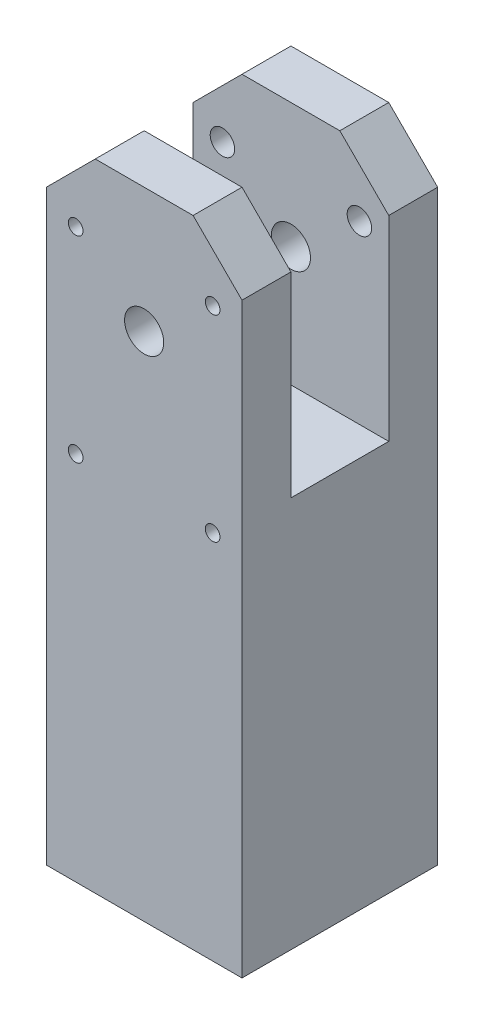
from build123d import *

# Parameters (mm, degrees)
SKETCH1_W           = 40
SKETCH1_H           = 40
BOSS_EXTRUDE1_DEPTH = 80
SKETCH4_W           = 40
SKETCH4_H           = 10
BOSS_EXTRUDE2_DEPTH = 50
CHAMFER1_SIZE       = 10
SKETCH5_R           = 4
CUT_EXTRUDE1_DEPTH  = 60
SKETCH6_R           = 1.5
CUT_EXTRUDE2_DEPTH  = 60
CHAMFER2_SIZE       = 2
SKETCH7_R           = 2.5
CUT_EXTRUDE3_DEPTH  = 20


with BuildPart() as part:
    # Sketch1 → Boss-Extrude1 (new body)
    with BuildSketch(Plane(origin=(0, 0, 0), x_dir=(1, 0, 0), z_dir=(0, 1, 0))):
        with Locations((-136.41025641, 40.096153846)):
            Rectangle(SKETCH1_W, SKETCH1_H)
    extrude(amount=BOSS_EXTRUDE1_DEPTH)

    # Sketch4 → Boss-Extrude2 (add)
    with BuildSketch(Plane(origin=(0, 80, 0), x_dir=(1, 0, 0), z_dir=(0, 1, 0))):
        with Locations((-136.41025641, 25.096153846)):
            Rectangle(SKETCH4_W, SKETCH4_H)
        with Locations((-136.41025641, 55.096153846)):
            Rectangle(SKETCH4_W, SKETCH4_H)
    extrude(amount=BOSS_EXTRUDE2_DEPTH)

    # Chamfer1
    chamfer1_edges = [part.edges().sort_by_distance(p)[0] for p in [
        (-156.41025641, 130, -25.096153846),
        (-116.41025641, 130, -25.096153846),
        (-156.41025641, 130, -55.096153846),
        (-116.41025641, 130, -55.096153846),
    ]]
    chamfer(chamfer1_edges, length=CHAMFER1_SIZE)

    # Sketch5 → Cut-Extrude1 (cut)
    with BuildSketch(Plane(origin=(0, 0, -60.096153846), x_dir=(-1, 0, 0), z_dir=(0, 0, -1))):
        with Locations((136.41025641, 104.479752215)):
            Circle(SKETCH5_R)
    extrude(amount=-CUT_EXTRUDE1_DEPTH, mode=Mode.SUBTRACT)

    # Sketch6 → Cut-Extrude2 (cut)
    with BuildSketch(Plane.XY.offset(-20.096153846)):
        with Locations((-150.41025641, 75.8)):
            Circle(SKETCH6_R)
        with Locations((-150.41025641, 116)):
            Circle(SKETCH6_R)
        with Locations((-122.41025641, 116)):
            Circle(SKETCH6_R)
        with Locations((-122.41025641, 75.8)):
            Circle(SKETCH6_R)
    extrude(amount=-CUT_EXTRUDE2_DEPTH, mode=Mode.SUBTRACT)

    # Chamfer2
    chamfer2_edges = [part.edges().sort_by_distance(p)[0] for p in [
        (-123.91025641, 116, -30.096153846),
        (-151.91025641, 116, -30.096153846),
    ]]
    chamfer(chamfer2_edges, length=CHAMFER2_SIZE)

    # Sketch7 → Cut-Extrude3 (cut)
    with BuildSketch(Plane(origin=(0, 0, -60.096153846), x_dir=(-1, 0, 0), z_dir=(0, 0, -1))):
        with Locations((150.41025641, 116)):
            Circle(SKETCH7_R)
        with Locations((122.41025641, 116)):
            Circle(SKETCH7_R)
    extrude(amount=-CUT_EXTRUDE3_DEPTH, mode=Mode.SUBTRACT)


solid = part.part
